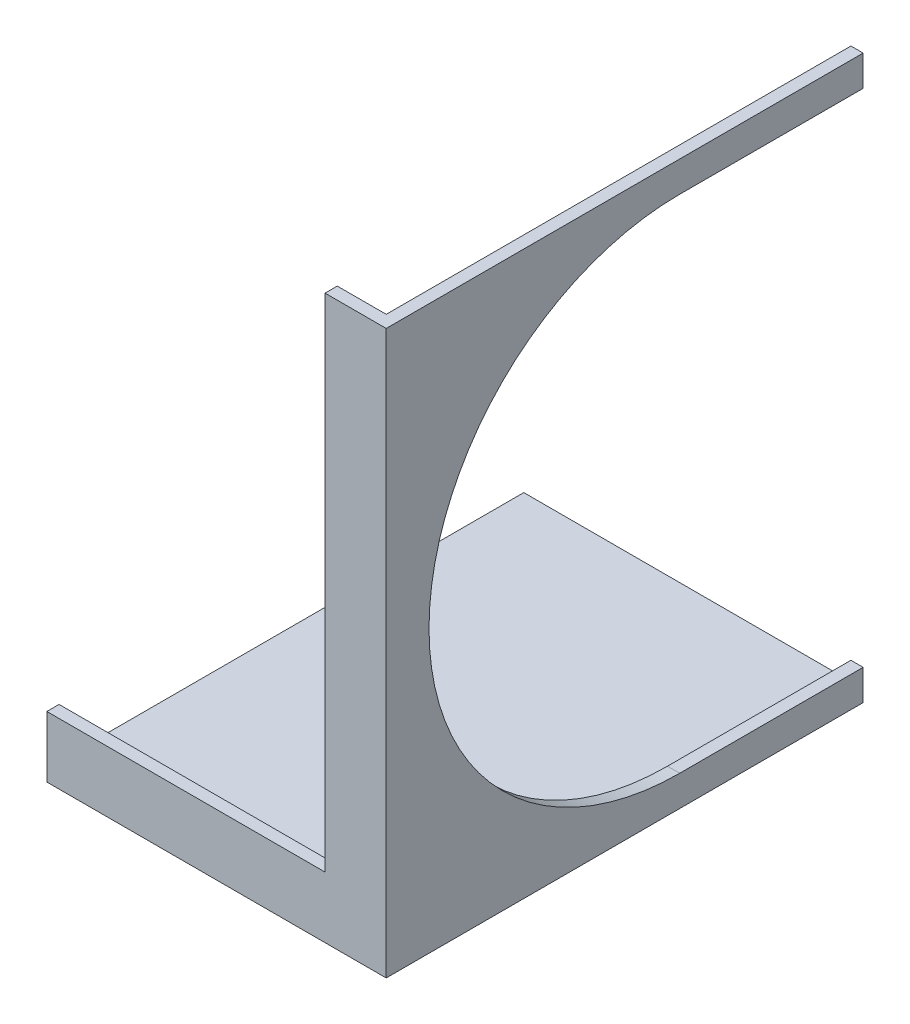
from build123d import *

# Parameters (mm, degrees)
EXTRUDE_1_DEPTH     = 76
CUT_EXTRUDE_1_DEPTH = 70
EXTRUDE_2_DEPTH     = 2


with BuildPart() as part:
    # 草图1 → 凸台-拉伸1 (new body)
    with BuildSketch(Plane.XY):
        Polygon((-55.5, 0), (0, 0), (0, 92), (-2, 92), (-2, 2), (-55.5, 2), align=None)
    extrude(amount=EXTRUDE_1_DEPTH)

    # 草图2 → 切除-拉伸1 (cut)
    with BuildSketch(Plane(origin=(0, 0, 0), x_dir=(0, 0, -1), z_dir=(1, 0, 0))):
        with BuildLine():
            Line((-30, 5), (0, 5))
            Line((0, 5), (0, 87))
            Line((0, 87), (-30, 87))
            ThreePointArc((-30, 87), (-71, 46), (-30, 5))
        make_face()
    extrude(amount=-CUT_EXTRUDE_1_DEPTH, mode=Mode.SUBTRACT)

    # 草图3 → 凸台-拉伸2 (add)
    with BuildSketch(Plane.XY.offset(76)):
        Polygon((0, 92), (-10, 92), (-10, 10), (-55.5, 10), (-55.5, 0), (0, 0), align=None)
    extrude(amount=EXTRUDE_2_DEPTH)


solid = part.part
